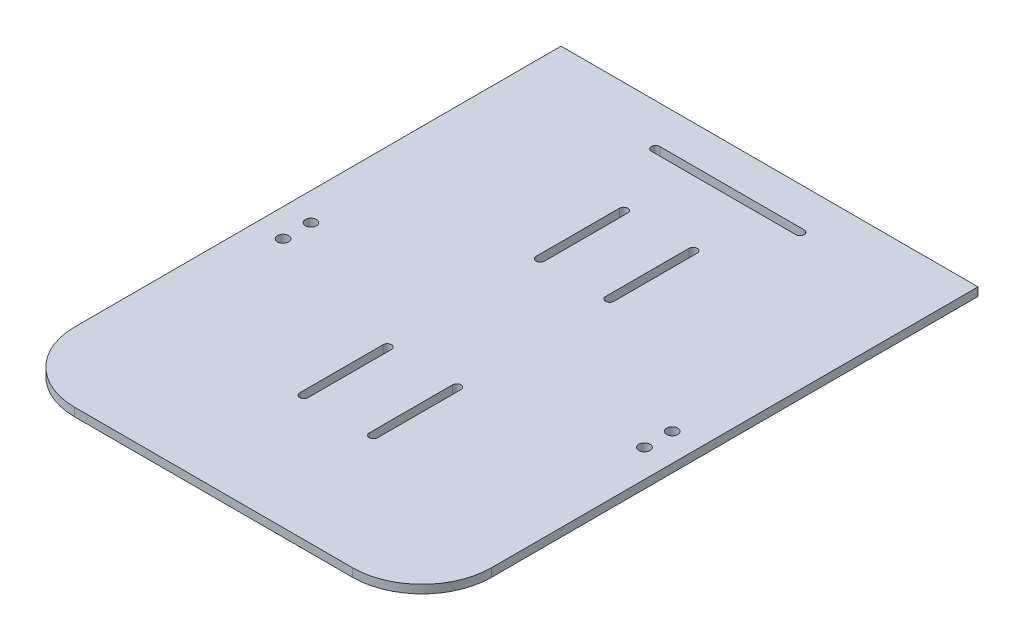
from build123d import *

# Parameters (mm, degrees)
SKETCH1_R           = 2
BOSS_EXTRUDE1_DEPTH = 3


with BuildPart() as part:
    # Sketch1 → Boss-Extrude1 (new body)
    with BuildSketch(Plane(origin=(0, 0, 0), x_dir=(1, 0, 0), z_dir=(0, 1, 0))):
        with BuildLine():
            Line((-50, 0), (50, 0))
            ThreePointArc((50, 0), (67.67766953, 7.32233047), (75, 25))
            Line((75, 25), (75, 200))
            Line((75, 200), (-75, 200))
            Line((-75, 200), (-75, 25))
            ThreePointArc((-75, 25), (-67.67766953, 7.32233047), (-50, 0))
        make_face()
        with Locations(Location((65, 100, 0), (0, 0, 270))):
            Circle(SKETCH1_R, mode=Mode.SUBTRACT)
        with Locations(Location((65, 90, 0), (0, 0, 270))):
            Circle(SKETCH1_R, mode=Mode.SUBTRACT)
        with Locations(Location((-65, 90, 0), (0, 0, 270))):
            Circle(SKETCH1_R, mode=Mode.SUBTRACT)
        with Locations(Location((-65, 100, 0), (0, 0, 270))):
            Circle(SKETCH1_R, mode=Mode.SUBTRACT)
        with BuildLine():
            Line((-25.977942191, 186.5), (25.977942191, 186.5))
            ThreePointArc((25.977942191, 186.5), (27.477942191, 185), (25.977942191, 183.5))
            Line((25.977942191, 183.5), (-25.977942191, 183.5))
            ThreePointArc((-25.977942191, 183.5), (-27.477942191, 185), (-25.977942191, 186.5))
        make_face(mode=Mode.SUBTRACT)
        with BuildLine():
            Line((14, 160), (14, 130))
            ThreePointArc((14, 130), (12.5, 128.5), (11, 130))
            Line((11, 130), (11, 160))
            ThreePointArc((11, 160), (12.5, 161.5), (14, 160))
        make_face(mode=Mode.SUBTRACT)
        with BuildLine():
            Line((14, 75), (14, 45))
            ThreePointArc((14, 45), (12.5, 43.5), (11, 45))
            Line((11, 45), (11, 75))
            ThreePointArc((11, 75), (12.5, 76.5), (14, 75))
        make_face(mode=Mode.SUBTRACT)
        with BuildLine():
            Line((-14, 75), (-14, 45))
            ThreePointArc((-14, 45), (-12.5, 43.5), (-11, 45))
            Line((-11, 45), (-11, 75))
            ThreePointArc((-11, 75), (-12.5, 76.5), (-14, 75))
        make_face(mode=Mode.SUBTRACT)
        with BuildLine():
            Line((-14, 160), (-14, 130))
            ThreePointArc((-14, 130), (-12.5, 128.5), (-11, 130))
            Line((-11, 130), (-11, 160))
            ThreePointArc((-11, 160), (-12.5, 161.5), (-14, 160))
        make_face(mode=Mode.SUBTRACT)
    extrude(amount=BOSS_EXTRUDE1_DEPTH)


solid = part.part
